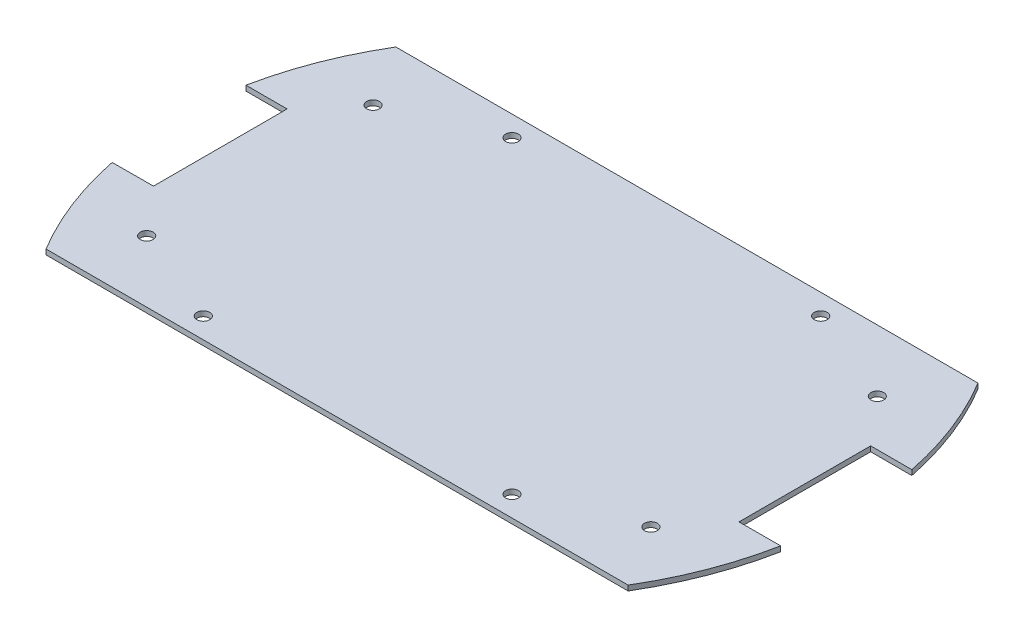
from build123d import *

# Parameters (mm, degrees)
EXTRUDE_2_DEPTH             = 1
M3X0_5_1_D                  = 2.5
M3X0_5_1_DEPTH              = 4
M3X0_5_1_TIP                = 0.751075774
M3X0_5_1_ON_FACE_2_D        = 2.5
M3X0_5_1_ON_FACE_2_DEPTH    = 4
M3X0_5_1_ON_FACE_2_TIP      = 0.751075774
PATTERN_LINEAR_1_COUNT      = 2
PATTERN_LINEAR_1_PITCH      = 98
PATTERN_LINEAR_1_COUNT_DIR2 = 2
PATTERN_LINEAR_1_PITCH_DIR2 = 44


with BuildPart() as part:
    # 草圖10 → 填料-伸長2 (new body)
    with BuildSketch(Plane(origin=(0, 0, 0), x_dir=(1, 0, 0), z_dir=(0, 1, 0))):
        with BuildLine():
            Line((56.568542495, 34), (-56.568542495, 34))
            ThreePointArc((-56.568542495, 34), (-61.540159626, 23.849711805), (-64.707032075, 13))
            Line((-64.707032075, 13), (-56.707032075, 13))
            Line((-56.707032075, 13), (-56.707032075, -12.973279994))
            Line((-56.707032075, -12.973279994), (-64.707032075, -13))
            ThreePointArc((-64.707032075, -13), (-61.540159626, -23.849711805), (-56.568542495, -34))
            Line((-56.568542495, -34), (56.568542495, -34))
            ThreePointArc((56.568542495, -34), (61.619473981, -23.644035746), (64.792427449, -12.567471713))
            Line((64.792427449, -12.567471713), (56.707032075, -12.594476939))
            Line((56.707032075, -12.594476939), (56.707032075, 13))
            Line((56.707032075, 13), (64.707032075, 13))
            ThreePointArc((64.707032075, 13), (61.540159626, 23.849711805), (56.568542495, 34))
        make_face()
    extrude(amount=EXTRUDE_2_DEPTH)

    # M3x0.5  螺絲攻的螺孔鑽1
    with Locations(Plane(origin=(30, 1, 30), x_dir=(0, 0, 1), z_dir=(0, 1, 0))):
        with Locations((0, 0), (-60, -60), (0, -60), (-60, 0)):
            Hole(M3X0_5_1_D / 2, depth=M3X0_5_1_DEPTH)
            with Locations((0, 0, -(M3X0_5_1_DEPTH + M3X0_5_1_TIP / 2))):  # 118° drill point
                Cone(0, M3X0_5_1_D / 2, M3X0_5_1_TIP, mode=Mode.SUBTRACT)

    # M3x0.5  螺絲攻的螺孔鑽1 on face 2
    with Locations(Plane(origin=(-30, 0, -30), x_dir=(0, 0, -1), z_dir=(0, -1, 0))):
        with Locations((0, 0)):
            Hole(M3X0_5_1_ON_FACE_2_D / 2, depth=M3X0_5_1_ON_FACE_2_DEPTH)
            with Locations((0, 0, -(M3X0_5_1_ON_FACE_2_DEPTH + M3X0_5_1_ON_FACE_2_TIP / 2))):  # 118° drill point
                Cone(0, M3X0_5_1_ON_FACE_2_D / 2, M3X0_5_1_ON_FACE_2_TIP, mode=Mode.SUBTRACT)

    # 草圖14 → M3x0.5  螺絲攻的螺孔鑽2 (revolve, cut)
    with BuildSketch(Plane(origin=(-49, 1, -22), x_dir=(0, 0, 1), z_dir=(1, 0, 0))):
        Polygon((0, 0), (0, 4.751075774), (1.25, 4), (1.25, 0), align=None)
    m3x0_5_2 = revolve(axis=Axis((-49, 7.35, -22), (0, -1, 0)), mode=Mode.SUBTRACT)

    # 直線複製排列1: M3x0.5 _2 2 × 2
    with Locations(*[(i * PATTERN_LINEAR_1_PITCH, 0, j * PATTERN_LINEAR_1_PITCH_DIR2) for i in range(PATTERN_LINEAR_1_COUNT) for j in range(PATTERN_LINEAR_1_COUNT_DIR2) if (i, j) != (0, 0)]):
        add(m3x0_5_2, mode=Mode.SUBTRACT)


solid = part.part
